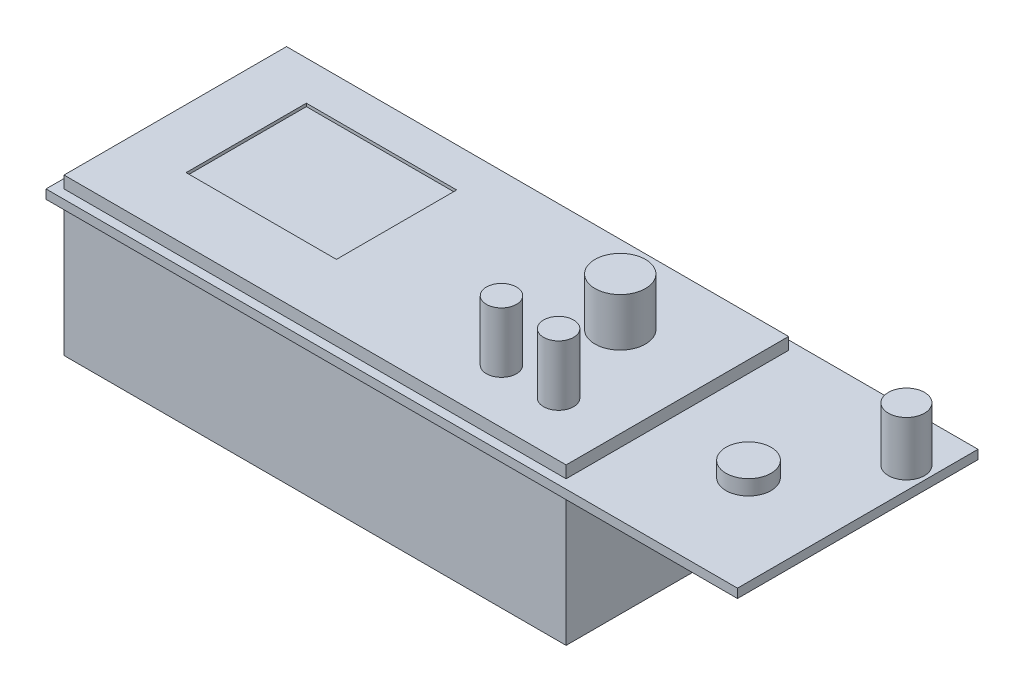
from build123d import *

# Parameters (mm, degrees)
SKETCH_1_W          = 230
SKETCH_1_H          = 80
EXTRUDE_1_DEPTH     = 3
SKETCH_2_W          = 167
SKETCH_2_H          = 74
EXTRUDE_2_DEPTH     = 4
SKETCH_3_W          = 50
SKETCH_3_H          = 40
CUT_EXTRUDE_1_DEPTH = 1
SKETCH_4_R          = 8.4
EXTRUDE_3_DEPTH     = 16
SKETCH_5_R          = 5
EXTRUDE_4_DEPTH     = 20
SKETCH_6_R          = 6
EXTRUDE_5_DEPTH     = 18
SKETCH_7_R          = 7.5
EXTRUDE_6_DEPTH     = 5
SKETCH_8_W          = 167
SKETCH_8_H          = 74
EXTRUDE_7_DEPTH     = 45


with BuildPart() as part:
    # 草图1 → 凸台-拉伸1 (new body)
    with BuildSketch(Plane(origin=(0, 0, 0), x_dir=(1, 0, 0), z_dir=(0, 1, 0))):
        with Locations((35.37586548, -1.78041543)):
            Rectangle(SKETCH_1_W, SKETCH_1_H)
    extrude(amount=EXTRUDE_1_DEPTH)

    # 草图2 → 凸台-拉伸2 (add)
    with BuildSketch(Plane(origin=(0, 3, 0), x_dir=(1, 0, 0), z_dir=(0, 1, 0))):
        with Locations((6.87586548, -1.78041543)):
            Rectangle(SKETCH_2_W, SKETCH_2_H)
    extrude(amount=EXTRUDE_2_DEPTH)

    # 草图3 → 切除-拉伸1 (cut)
    with BuildSketch(Plane(origin=(0, 7, 0), x_dir=(1, 0, 0), z_dir=(0, 1, 0))):
        with Locations((-32.02413452, 2.21958457)):
            Rectangle(SKETCH_3_W, SKETCH_3_H)
    extrude(amount=-CUT_EXTRUDE_1_DEPTH, mode=Mode.SUBTRACT)

    # 草图4 → 凸台-拉伸3 (add)
    with BuildSketch(Plane(origin=(0, 7, 0), x_dir=(1, 0, 0), z_dir=(0, 1, 0))):
        with Locations(Location((60.37586548, 9.21958457, 0), (0, 0, 270))):
            Circle(SKETCH_4_R)
    extrude(amount=EXTRUDE_3_DEPTH)

    # 草图5 → 凸台-拉伸4 (add)
    with BuildSketch(Plane(origin=(0, 7, 0), x_dir=(1, 0, 0), z_dir=(0, 1, 0))):
        with Locations(Location((50.87586548, -20.78041543, 0), (0, 0, 270))):
            Circle(SKETCH_5_R)
        with Locations(Location((69.87586548, -20.78041543, 0), (0, 0, 270))):
            Circle(SKETCH_5_R)
    extrude(amount=EXTRUDE_4_DEPTH)

    # 草图6 → 凸台-拉伸5 (add)
    with BuildSketch(Plane(origin=(0, 3, 0), x_dir=(1, 0, 0), z_dir=(0, 1, 0))):
        with Locations(Location((143.07586548, 21.71958457, 0), (0, 0, 270))):
            Circle(SKETCH_6_R)
    extrude(amount=EXTRUDE_5_DEPTH)

    # 草图7 → 凸台-拉伸6 (add)
    with BuildSketch(Plane(origin=(0, 3, 0), x_dir=(1, 0, 0), z_dir=(0, 1, 0))):
        with Locations(Location((120.37586548, -8.108420441, 0), (0, 0, 270))):
            Circle(SKETCH_7_R)
    extrude(amount=EXTRUDE_6_DEPTH)

    # 草图8 → 凸台-拉伸7 (add)
    with BuildSketch(Plane.XZ):
        with Locations((6.87586548, 1.78041543)):
            Rectangle(SKETCH_8_W, SKETCH_8_H)
    extrude(amount=EXTRUDE_7_DEPTH)


solid = part.part
